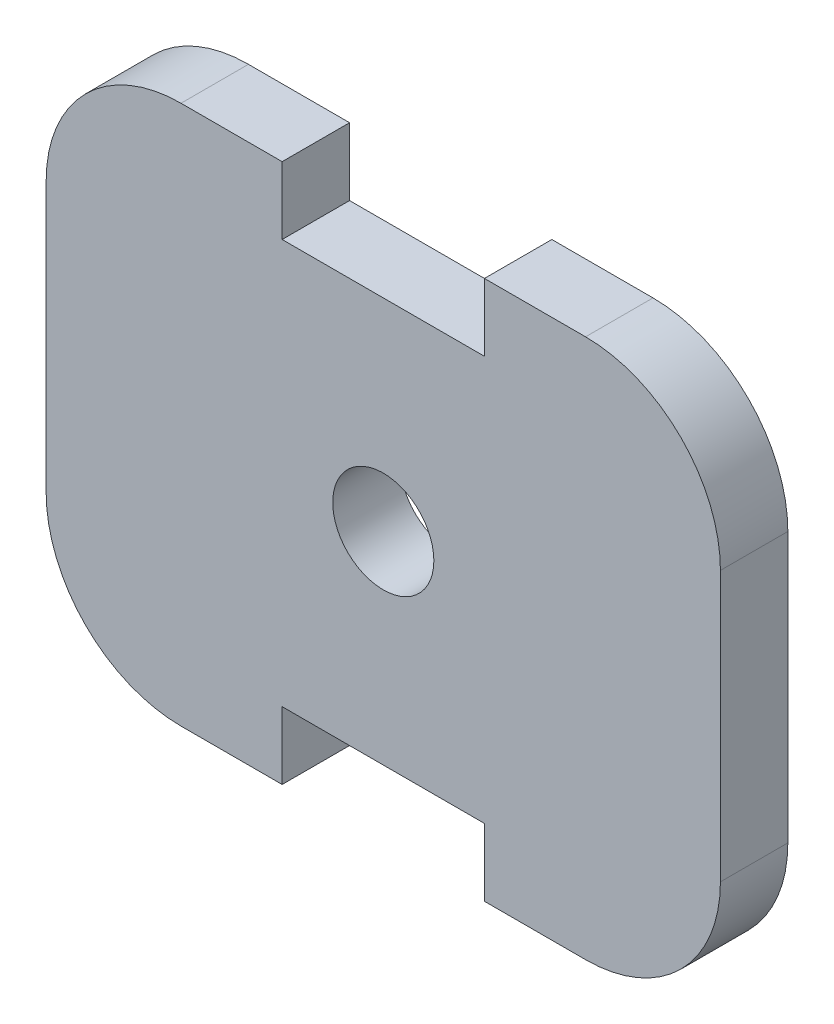
from build123d import *

# Parameters (mm, degrees)
SKETCH1_R           = 2.38125
BOSS_EXTRUDE1_DEPTH = 3.175


with BuildPart() as part:
    # Sketch1 → Boss-Extrude1 (new body)
    with BuildSketch(Plane.XY):
        with BuildLine():
            Line((1.5875, 21.137006158), (-3.175, 21.137006158))
            ThreePointArc((-3.175, 21.137006158), (-7.665128061, 19.277134219), (-9.525, 14.787006158))
            Line((-9.525, 14.787006158), (-9.525, 2.087006158))
            ThreePointArc((-9.525, 2.087006158), (-7.665128061, -2.403121902), (-3.175, -4.262993842))
            Line((-3.175, -4.262993842), (1.5875, -4.262993842))
            Line((1.5875, -4.262993842), (1.5875, -1.087993842))
            Line((1.5875, -1.087993842), (11.1125, -1.087993842))
            Line((11.1125, -1.087993842), (11.1125, -4.262993842))
            Line((11.1125, -4.262993842), (15.875, -4.262993842))
            ThreePointArc((15.875, -4.262993842), (20.365128061, -2.403121902), (22.225, 2.087006158))
            Line((22.225, 2.087006158), (22.225, 14.787006158))
            ThreePointArc((22.225, 14.787006158), (20.365128061, 19.277134219), (15.875, 21.137006158))
            Line((15.875, 21.137006158), (11.1125, 21.137006158))
            Line((11.1125, 21.137006158), (11.1125, 17.962006158))
            Line((11.1125, 17.962006158), (1.5875, 17.962006158))
            Line((1.5875, 17.962006158), (1.5875, 21.137006158))
        make_face()
        with Locations((6.35, 8.437006158)):
            Circle(SKETCH1_R, mode=Mode.SUBTRACT)
    extrude(amount=BOSS_EXTRUDE1_DEPTH)


solid = part.part
